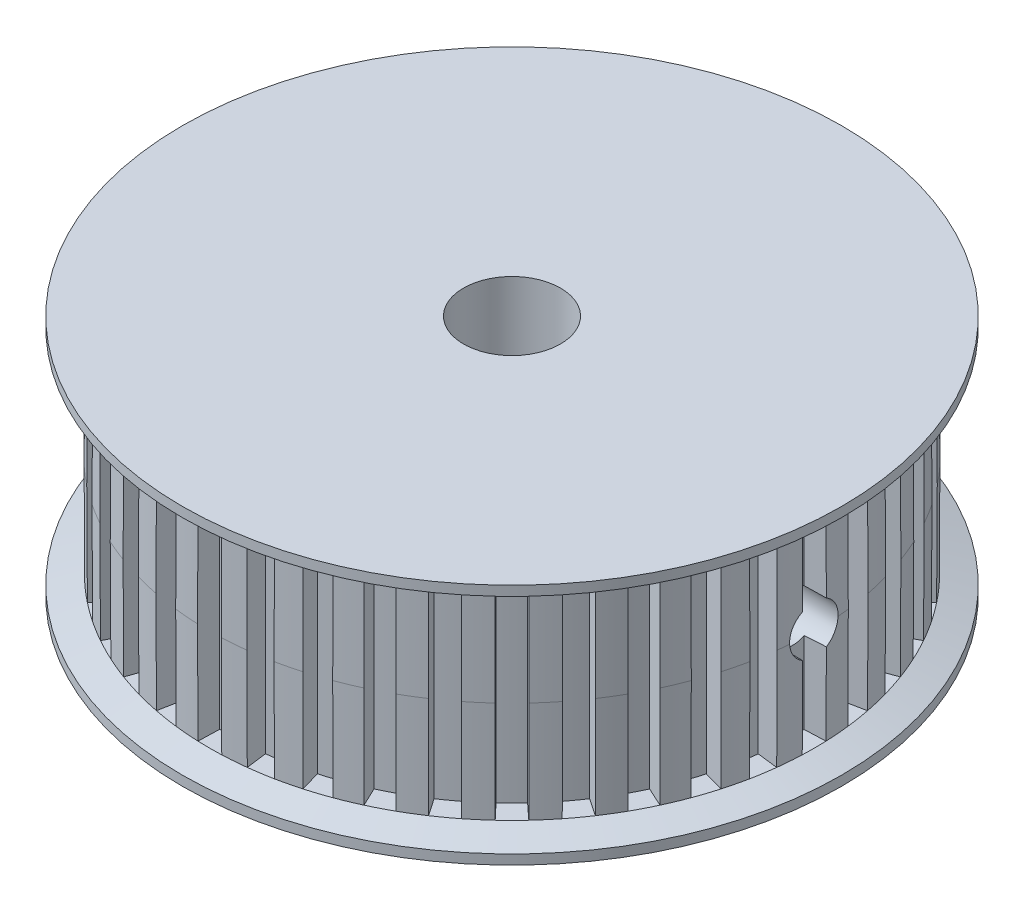
from build123d import *

# Parameters (mm, degrees)
SKETCH_1_R          = 34
EXTRUDE_1_DEPTH     = 2
SKETCH_2_R          = 31.25
EXTRUDE_2_DEPTH     = 21
CUT_EXTRUDE_START   = -21
CUT_EXTRUDE_1_DEPTH = 21
SKETCH_3_R          = 34
EXTRUDE_3_DEPTH     = 2
SKETCH_7_R          = 5
CUT_EXTRUDE_2_DEPTH = 55.194095619
SKETCH_9_R          = 2.5
CUT_EXTRUDE_3_DEPTH = 50


with BuildPart() as part:
    # 草图1 → 凸台-拉伸1 (new body)
    with BuildSketch(Plane(origin=(0, 0, 0), x_dir=(1, 0, 0), z_dir=(0, 1, 0))):
        with Locations(Location((0, 0, 0), (0, 0, 270))):
            Circle(SKETCH_1_R)
    extrude(amount=EXTRUDE_1_DEPTH)

    # 草图2 → 凸台-拉伸2 (add)
    with BuildSketch(Plane(origin=(0, 2, 0), x_dir=(1, 0, 0), z_dir=(0, 1, 0))):
        with Locations(Location((0, 0, 0), (0, 0, 90))):
            Circle(SKETCH_2_R)
    extrude(amount=EXTRUDE_2_DEPTH)

    # 草图4 → 切除-拉伸1 (cut)
    with BuildSketch(Plane(origin=(0, 23, 0), x_dir=(1, 0, 0), z_dir=(0, 1, 0)).offset(CUT_EXTRUDE_START)):
        with BuildLine():
            Line((1.165464781, 28.97657143), (1.226869242, 31.225907383))
            ThreePointArc((1.226869242, 31.225907383), (0, 31.25), (-1.226869242, 31.225907383))
            Line((-1.226869242, 31.225907383), (-1.138534657, 28.977642051))
            ThreePointArc((-1.138534657, 28.977642051), (0.013475699, 28.999996869), (1.165464781, 28.97657143))
        make_face()
        with BuildLine():
            Line((3.408584526, 28.798985252), (3.673043671, 31.03338928))
            ThreePointArc((3.673043671, 31.03338928), (4.888577033, 30.865260644), (6.096572563, 30.649540013))
            Line((6.096572563, 30.649540013), (5.684050426, 28.437502892))
            ThreePointArc((5.684050426, 28.437502892), (4.549908787, 28.640850721), (3.408584526, 28.798985252))
        make_face()
        with BuildLine():
            Line((7.871773046, 27.911201857), (8.482514058, 30.076726139))
            ThreePointArc((8.482514058, 30.076726139), (9.656781074, 29.720516134), (10.816158034, 29.318479248))
            Line((10.816158034, 29.318479248), (10.062675885, 27.198208655))
            ThreePointArc((10.062675885, 27.198208655), (8.97430802, 27.576471775), (7.871773046, 27.911201857))
        make_face()
        with BuildLine():
            Line((12.141132389, 26.336152041), (13.083116798, 28.379474182))
            ThreePointArc((13.083116798, 28.379474182), (14.187203117, 27.843953881), (15.269413797, 27.265500221))
            Line((15.269413797, 27.265500221), (14.193524868, 25.289204254))
            ThreePointArc((14.193524868, 25.289204254), (13.177730007, 25.833068573), (12.141132389, 26.336152041))
        make_face()
        with BuildLine():
            Line((16.111536758, 24.112618757), (17.361569782, 25.983425384))
            ThreePointArc((17.361569782, 25.983425384), (18.368289134, 25.281781074), (19.346685916, 24.54115409))
            Line((19.346685916, 24.54115409), (17.974882163, 22.757495715))
            ThreePointArc((17.974882163, 22.757495715), (17.056672545, 23.453569487), (16.111536758, 24.112618757))
        make_face()
        with BuildLine():
            Line((19.68522162, 21.295352774), (21.212523298, 22.94757842))
            ThreePointArc((21.212523298, 22.94757842), (22.097086912, 22.097086912), (22.94757842, 21.212523298))
            Line((22.94757842, 21.212523298), (21.313638204, 19.665422104))
            ThreePointArc((21.313638204, 19.665422104), (20.515623198, 20.496565683), (19.68522162, 21.295352774))
        make_face()
        with BuildLine():
            Line((22.774190996, 17.95372453), (24.54115409, 19.346685916))
            ThreePointArc((24.54115409, 19.346685916), (25.281781074, 18.368289134), (25.983425384, 17.361569782))
            Line((25.983425384, 17.361569782), (24.127581736, 16.089120534))
            ThreePointArc((24.127581736, 16.089120534), (23.469411121, 17.034868407), (22.774190996, 17.95372453))
        make_face()
        with BuildLine():
            Line((25.302384205, 14.170016003), (27.265500221, 15.269413797))
            ThreePointArc((27.265500221, 15.269413797), (27.843953881, 14.187203117), (28.379474182, 13.083116798))
            Line((28.379474182, 13.083116798), (26.347424131, 12.11665142))
            ThreePointArc((26.347424131, 12.11665142), (25.845304251, 13.153716136), (25.302384205, 14.170016003))
        make_face()
        with BuildLine():
            Line((27.207548742, 10.037394655), (29.318479248, 10.816158034))
            ThreePointArc((29.318479248, 10.816158034), (29.720516134, 9.656781074), (30.076726139, 8.482514058))
            Line((30.076726139, 8.482514058), (27.918505502, 7.845830136))
            ThreePointArc((27.918505502, 7.845830136), (27.584800215, 8.948675718), (27.207548742, 10.037394655))
        make_face()
        with BuildLine():
            Line((28.442773132, 5.657619338), (30.649540013, 6.096572563))
            ThreePointArc((30.649540013, 6.096572563), (30.865260644, 4.888577033), (31.03338928, 3.673043671))
            Line((31.03338928, 3.673043671), (28.802140612, 3.381818474))
            ThreePointArc((28.802140612, 3.381818474), (28.645066849, 4.523289206), (28.442773132, 5.657619338))
        make_face()
        with BuildLine():
            Line((28.977642051, 1.138534657), (31.225907383, 1.226869242))
            ThreePointArc((31.225907383, 1.226869242), (31.25, 0), (31.225907383, -1.226869242))
            Line((31.225907383, -1.226869242), (28.97657143, -1.165464781))
            ThreePointArc((28.97657143, -1.165464781), (28.999996869, -0.013475699), (28.977642051, 1.138534657))
        make_face()
        with BuildLine():
            Line((28.798985252, -3.408584526), (31.03338928, -3.673043671))
            ThreePointArc((31.03338928, -3.673043671), (30.865260644, -4.888577033), (30.649540013, -6.096572563))
            Line((30.649540013, -6.096572563), (28.437502892, -5.684050426))
            ThreePointArc((28.437502892, -5.684050426), (28.640850721, -4.549908787), (28.798985252, -3.408584526))
        make_face()
        with BuildLine():
            Line((27.911201857, -7.871773046), (30.076726139, -8.482514058))
            ThreePointArc((30.076726139, -8.482514058), (29.720516134, -9.656781074), (29.318479248, -10.816158034))
            Line((29.318479248, -10.816158034), (27.198208655, -10.062675885))
            ThreePointArc((27.198208655, -10.062675885), (27.576471775, -8.97430802), (27.911201857, -7.871773046))
        make_face()
        with BuildLine():
            Line((26.336152041, -12.141132389), (28.379474182, -13.083116798))
            ThreePointArc((28.379474182, -13.083116798), (27.843953881, -14.187203117), (27.265500221, -15.269413797))
            Line((27.265500221, -15.269413797), (25.289204254, -14.193524868))
            ThreePointArc((25.289204254, -14.193524868), (25.833068573, -13.177730007), (26.336152041, -12.141132389))
        make_face()
        with BuildLine():
            Line((24.112618757, -16.111536758), (25.983425384, -17.361569782))
            ThreePointArc((25.983425384, -17.361569782), (25.281781074, -18.368289134), (24.54115409, -19.346685916))
            Line((24.54115409, -19.346685916), (22.757495715, -17.974882163))
            ThreePointArc((22.757495715, -17.974882163), (23.453569487, -17.056672545), (24.112618757, -16.111536758))
        make_face()
        with BuildLine():
            Line((21.295352774, -19.68522162), (22.94757842, -21.212523298))
            ThreePointArc((22.94757842, -21.212523298), (22.097086912, -22.097086912), (21.212523298, -22.94757842))
            Line((21.212523298, -22.94757842), (19.665422104, -21.313638204))
            ThreePointArc((19.665422104, -21.313638204), (20.496565683, -20.515623198), (21.295352774, -19.68522162))
        make_face()
        with BuildLine():
            Line((17.95372453, -22.774190996), (19.346685916, -24.54115409))
            ThreePointArc((19.346685916, -24.54115409), (18.368289134, -25.281781074), (17.361569782, -25.983425384))
            Line((17.361569782, -25.983425384), (16.089120534, -24.127581736))
            ThreePointArc((16.089120534, -24.127581736), (17.034868407, -23.469411121), (17.95372453, -22.774190996))
        make_face()
        with BuildLine():
            Line((14.170016003, -25.302384205), (15.269413797, -27.265500221))
            ThreePointArc((15.269413797, -27.265500221), (14.187203117, -27.843953881), (13.083116798, -28.379474182))
            Line((13.083116798, -28.379474182), (12.11665142, -26.347424131))
            ThreePointArc((12.11665142, -26.347424131), (13.153716136, -25.845304251), (14.170016003, -25.302384205))
        make_face()
        with BuildLine():
            Line((10.037394655, -27.207548742), (10.816158034, -29.318479248))
            ThreePointArc((10.816158034, -29.318479248), (9.656781074, -29.720516134), (8.482514058, -30.076726139))
            Line((8.482514058, -30.076726139), (7.845830136, -27.918505502))
            ThreePointArc((7.845830136, -27.918505502), (8.948675718, -27.584800215), (10.037394655, -27.207548742))
        make_face()
        with BuildLine():
            Line((5.657619338, -28.442773132), (6.096572563, -30.649540013))
            ThreePointArc((6.096572563, -30.649540013), (4.888577033, -30.865260644), (3.673043671, -31.03338928))
            Line((3.673043671, -31.03338928), (3.381818474, -28.802140612))
            ThreePointArc((3.381818474, -28.802140612), (4.523289206, -28.645066849), (5.657619338, -28.442773132))
        make_face()
        with BuildLine():
            Line((1.138534657, -28.977642051), (1.226869242, -31.225907383))
            ThreePointArc((1.226869242, -31.225907383), (0, -31.25), (-1.226869242, -31.225907383))
            Line((-1.226869242, -31.225907383), (-1.165464781, -28.97657143))
            ThreePointArc((-1.165464781, -28.97657143), (-0.013475699, -28.999996869), (1.138534657, -28.977642051))
        make_face()
        with BuildLine():
            Line((-3.408584526, -28.798985252), (-3.673043671, -31.03338928))
            ThreePointArc((-3.673043671, -31.03338928), (-4.888577033, -30.865260644), (-6.096572563, -30.649540013))
            Line((-6.096572563, -30.649540013), (-5.684050426, -28.437502892))
            ThreePointArc((-5.684050426, -28.437502892), (-4.549908787, -28.640850721), (-3.408584526, -28.798985252))
        make_face()
        with BuildLine():
            Line((-7.871773046, -27.911201857), (-8.482514058, -30.076726139))
            ThreePointArc((-8.482514058, -30.076726139), (-9.656781074, -29.720516134), (-10.816158034, -29.318479248))
            Line((-10.816158034, -29.318479248), (-10.062675885, -27.198208655))
            ThreePointArc((-10.062675885, -27.198208655), (-8.97430802, -27.576471775), (-7.871773046, -27.911201857))
        make_face()
        with BuildLine():
            Line((-12.141132389, -26.336152041), (-13.083116798, -28.379474182))
            ThreePointArc((-13.083116798, -28.379474182), (-14.187203117, -27.843953881), (-15.269413797, -27.265500221))
            Line((-15.269413797, -27.265500221), (-14.193524868, -25.289204254))
            ThreePointArc((-14.193524868, -25.289204254), (-13.177730007, -25.833068573), (-12.141132389, -26.336152041))
        make_face()
        with BuildLine():
            Line((-16.111536758, -24.112618757), (-17.361569782, -25.983425384))
            ThreePointArc((-17.361569782, -25.983425384), (-18.368289134, -25.281781074), (-19.346685916, -24.54115409))
            Line((-19.346685916, -24.54115409), (-17.974882163, -22.757495715))
            ThreePointArc((-17.974882163, -22.757495715), (-17.056672545, -23.453569487), (-16.111536758, -24.112618757))
        make_face()
        with BuildLine():
            Line((-19.68522162, -21.295352774), (-21.212523298, -22.94757842))
            ThreePointArc((-21.212523298, -22.94757842), (-22.097086912, -22.097086912), (-22.94757842, -21.212523298))
            Line((-22.94757842, -21.212523298), (-21.313638204, -19.665422104))
            ThreePointArc((-21.313638204, -19.665422104), (-20.515623198, -20.496565683), (-19.68522162, -21.295352774))
        make_face()
        with BuildLine():
            Line((-22.774190996, -17.95372453), (-24.54115409, -19.346685916))
            ThreePointArc((-24.54115409, -19.346685916), (-25.281781074, -18.368289134), (-25.983425384, -17.361569782))
            Line((-25.983425384, -17.361569782), (-24.127581736, -16.089120534))
            ThreePointArc((-24.127581736, -16.089120534), (-23.469411121, -17.034868407), (-22.774190996, -17.95372453))
        make_face()
        with BuildLine():
            Line((-25.302384205, -14.170016003), (-27.265500221, -15.269413797))
            ThreePointArc((-27.265500221, -15.269413797), (-27.843953881, -14.187203117), (-28.379474182, -13.083116798))
            Line((-28.379474182, -13.083116798), (-26.347424131, -12.11665142))
            ThreePointArc((-26.347424131, -12.11665142), (-25.845304251, -13.153716136), (-25.302384205, -14.170016003))
        make_face()
        with BuildLine():
            Line((-27.207548742, -10.037394655), (-29.318479248, -10.816158034))
            ThreePointArc((-29.318479248, -10.816158034), (-29.720516134, -9.656781074), (-30.076726139, -8.482514058))
            Line((-30.076726139, -8.482514058), (-27.918505502, -7.845830136))
            ThreePointArc((-27.918505502, -7.845830136), (-27.584800215, -8.948675718), (-27.207548742, -10.037394655))
        make_face()
        with BuildLine():
            Line((-28.442773132, -5.657619338), (-30.649540013, -6.096572563))
            ThreePointArc((-30.649540013, -6.096572563), (-30.865260644, -4.888577033), (-31.03338928, -3.673043671))
            Line((-31.03338928, -3.673043671), (-28.802140612, -3.381818474))
            ThreePointArc((-28.802140612, -3.381818474), (-28.645066849, -4.523289206), (-28.442773132, -5.657619338))
        make_face()
        with BuildLine():
            Line((-28.977642051, -1.138534657), (-31.225907383, -1.226869242))
            ThreePointArc((-31.225907383, -1.226869242), (-31.25, 0), (-31.225907383, 1.226869242))
            Line((-31.225907383, 1.226869242), (-28.97657143, 1.165464781))
            ThreePointArc((-28.97657143, 1.165464781), (-28.999996869, 0.013475699), (-28.977642051, -1.138534657))
        make_face()
        with BuildLine():
            Line((-28.798985252, 3.408584526), (-31.03338928, 3.673043671))
            ThreePointArc((-31.03338928, 3.673043671), (-30.865260644, 4.888577033), (-30.649540013, 6.096572563))
            Line((-30.649540013, 6.096572563), (-28.437502892, 5.684050426))
            ThreePointArc((-28.437502892, 5.684050426), (-28.640850721, 4.549908787), (-28.798985252, 3.408584526))
        make_face()
        with BuildLine():
            Line((-27.911201857, 7.871773046), (-30.076726139, 8.482514058))
            ThreePointArc((-30.076726139, 8.482514058), (-29.720516134, 9.656781074), (-29.318479248, 10.816158034))
            Line((-29.318479248, 10.816158034), (-27.198208655, 10.062675885))
            ThreePointArc((-27.198208655, 10.062675885), (-27.576471775, 8.97430802), (-27.911201857, 7.871773046))
        make_face()
        with BuildLine():
            Line((-26.336152041, 12.141132389), (-28.379474182, 13.083116798))
            ThreePointArc((-28.379474182, 13.083116798), (-27.843953881, 14.187203117), (-27.265500221, 15.269413797))
            Line((-27.265500221, 15.269413797), (-25.289204254, 14.193524868))
            ThreePointArc((-25.289204254, 14.193524868), (-25.833068573, 13.177730007), (-26.336152041, 12.141132389))
        make_face()
        with BuildLine():
            Line((-24.112618757, 16.111536758), (-25.983425384, 17.361569782))
            ThreePointArc((-25.983425384, 17.361569782), (-25.281781074, 18.368289134), (-24.54115409, 19.346685916))
            Line((-24.54115409, 19.346685916), (-22.757495715, 17.974882163))
            ThreePointArc((-22.757495715, 17.974882163), (-23.453569487, 17.056672545), (-24.112618757, 16.111536758))
        make_face()
        with BuildLine():
            Line((-21.295352774, 19.68522162), (-22.94757842, 21.212523298))
            ThreePointArc((-22.94757842, 21.212523298), (-22.097086912, 22.097086912), (-21.212523298, 22.94757842))
            Line((-21.212523298, 22.94757842), (-19.665422104, 21.313638204))
            ThreePointArc((-19.665422104, 21.313638204), (-20.496565683, 20.515623198), (-21.295352774, 19.68522162))
        make_face()
        with BuildLine():
            Line((-17.95372453, 22.774190996), (-19.346685916, 24.54115409))
            ThreePointArc((-19.346685916, 24.54115409), (-18.368289134, 25.281781074), (-17.361569782, 25.983425384))
            Line((-17.361569782, 25.983425384), (-16.089120534, 24.127581736))
            ThreePointArc((-16.089120534, 24.127581736), (-17.034868407, 23.469411121), (-17.95372453, 22.774190996))
        make_face()
        with BuildLine():
            Line((-14.170016003, 25.302384205), (-15.269413797, 27.265500221))
            ThreePointArc((-15.269413797, 27.265500221), (-14.187203117, 27.843953881), (-13.083116798, 28.379474182))
            Line((-13.083116798, 28.379474182), (-12.11665142, 26.347424131))
            ThreePointArc((-12.11665142, 26.347424131), (-13.153716136, 25.845304251), (-14.170016003, 25.302384205))
        make_face()
        with BuildLine():
            Line((-10.037394655, 27.207548742), (-10.816158034, 29.318479248))
            ThreePointArc((-10.816158034, 29.318479248), (-9.656781074, 29.720516134), (-8.482514058, 30.076726139))
            Line((-8.482514058, 30.076726139), (-7.845830136, 27.918505502))
            ThreePointArc((-7.845830136, 27.918505502), (-8.948675718, 27.584800215), (-10.037394655, 27.207548742))
        make_face()
        with BuildLine():
            Line((-5.657619338, 28.442773132), (-6.096572563, 30.649540013))
            ThreePointArc((-6.096572563, 30.649540013), (-4.888577033, 30.865260644), (-3.673043671, 31.03338928))
            Line((-3.673043671, 31.03338928), (-3.381818474, 28.802140612))
            ThreePointArc((-3.381818474, 28.802140612), (-4.523289206, 28.645066849), (-5.657619338, 28.442773132))
        make_face()
    extrude(amount=CUT_EXTRUDE_1_DEPTH, mode=Mode.SUBTRACT)

    # 草图3 → 凸台-拉伸3 (add)
    with BuildSketch(Plane(origin=(0, 23, 0), x_dir=(1, 0, 0), z_dir=(0, 1, 0))):
        with Locations(Location((0, 0, 0), (0, 0, 270))):
            Circle(SKETCH_3_R)
    extrude(amount=EXTRUDE_3_DEPTH)

    # 切除-扫描1: sweep along a path in 草图6
    with BuildLine(Plane(origin=(0, 0, 0), x_dir=(1, 0, 0), z_dir=(0, 1, 0))) as sweep_1_path:
        CenterArc((0, 0), 34, 0, 360)
    # 草图5 → 切除-扫描1 (sweep, cut)
    with BuildSketch(Plane(origin=(0, 0, 0), x_dir=(0, 0, -1), z_dir=(1, 0, 0))):
        Polygon((-31.178551662, 2), (-31.225907383, 12.5), (-31.178551662, 23), (-34, 24), (-34, 1), align=None)
    sweep(path=sweep_1_path.line, mode=Mode.SUBTRACT)

    # 草图7 → 切除-拉伸2 (cut, through all)
    with BuildSketch(Plane.XZ):
        with Locations(Location((0, 0, 0), (0, 0, 270))):
            Circle(SKETCH_7_R)
    extrude(amount=-CUT_EXTRUDE_2_DEPTH, mode=Mode.SUBTRACT)

    # 草图9 → 切除-拉伸3 (cut)
    with BuildSketch(Plane(origin=(52, 0, 0), x_dir=(0, 0, -1), z_dir=(1, 0, 0))):
        with Locations((0, 12.619514472)):
            Circle(SKETCH_9_R)
    extrude(amount=-CUT_EXTRUDE_3_DEPTH, mode=Mode.SUBTRACT)


solid = part.part
